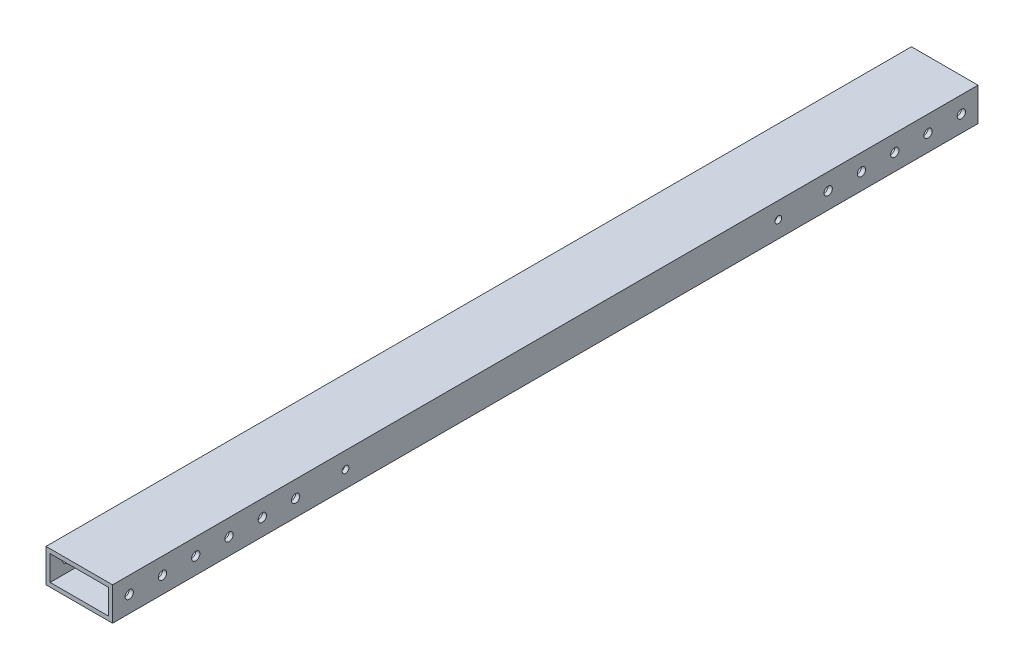
from build123d import *

# Parameters (mm, degrees)
BOSS_EXTRUDE1_DEPTH              = 330.2
BOSS_EXTRUDE1_DEPTH_BACK         = 330.2
SKETCH3_W                        = 50.8
SKETCH3_H                        = 25.4
SKETCH3_W_2                      = 44.45
SKETCH3_H_2                      = 19.05
F_1_4_0_25_DIAMETER_HOLE3_D      = 6.35
F_1_4_0_25_DIAMETER_HOLE4_D      = 6.35
F_1_4_0_25_DIAMETER_HOLE5_D      = 6.35
F_1_4_0_25_DIAMETER_HOLE6_D      = 6.35
F_1_4_0_25_DIAMETER_HOLE7_D      = 6.35
F_1_4_0_25_DIAMETER_HOLE8_D      = 6.35
F_13_64_0_20313_DIAMETER_HOLE1_D = 5.159502
F_1_2_0_5_DIAMETER_HOLE1_D       = 12.7
F_1_2_0_5_DIAMETER_HOLE1_DEPTH   = 6.35
F_1_2_0_5_DIAMETER_HOLE1_TIP     = 3.815464931


with BuildPart() as part:
    # Sketch3 → Boss-Extrude1 (new, two sides: drawn at the far end of the back side and taken through both)
    with BuildSketch(Plane.XY.offset(-BOSS_EXTRUDE1_DEPTH_BACK)):
        Rectangle(SKETCH3_W, SKETCH3_H)
        Rectangle(SKETCH3_W_2, SKETCH3_H_2, mode=Mode.SUBTRACT)
    extrude(amount=BOSS_EXTRUDE1_DEPTH + BOSS_EXTRUDE1_DEPTH_BACK)

    # 1/4 (0.25) Diameter Hole3 (through all)
    with Locations(Plane.ZY.offset(25.4)):
        with Locations((-317.5, 0)):
            Hole(F_1_4_0_25_DIAMETER_HOLE3_D / 2)

    # 1/4 (0.25) Diameter Hole4 (through all)
    with Locations(Plane.ZY.offset(25.4)):
        with Locations((292.1, 0), (317.5, 0)):
            Hole(F_1_4_0_25_DIAMETER_HOLE4_D / 2)

    # 1/4 (0.25) Diameter Hole5 (through all)
    with Locations(Plane(origin=(25.4, 0, 0), x_dir=(0, 0, -1), z_dir=(1, 0, 0))):
        with Locations((292.1, 0), (266.7, 0)):
            Hole(F_1_4_0_25_DIAMETER_HOLE5_D / 2)

    # 1/4 (0.25) Diameter Hole6 (through all)
    with Locations(Plane(origin=(25.4, 0, 0), x_dir=(0, 0, -1), z_dir=(1, 0, 0))):
        with Locations((215.9, 0), (241.3, 0)):
            Hole(F_1_4_0_25_DIAMETER_HOLE6_D / 2)

    # 1/4 (0.25) Diameter Hole7 (through all)
    with Locations(Plane(origin=(25.4, 0, 0), x_dir=(0, 0, -1), z_dir=(1, 0, 0))):
        with Locations((-190.5, 0), (-215.9, 0)):
            Hole(F_1_4_0_25_DIAMETER_HOLE7_D / 2)

    # 1/4 (0.25) Diameter Hole8 (through all)
    with Locations(Plane(origin=(25.4, 0, 0), x_dir=(0, 0, -1), z_dir=(1, 0, 0))):
        with Locations((-266.7, 0), (-241.3, 0)):
            Hole(F_1_4_0_25_DIAMETER_HOLE8_D / 2)

    # 13/64 (0.20313) Diameter Hole1 (through all)
    with Locations(Plane(origin=(25.4, 0, 0), x_dir=(0, 0, -1), z_dir=(1, 0, 0))):
        with Locations((-152.4, 0), (177.8, 0)):
            Hole(F_13_64_0_20313_DIAMETER_HOLE1_D / 2)

    # 1/2 (0.5) Diameter Hole1
    with Locations(Plane.ZY.offset(25.4)):
        with Locations((-146.050000508, 4.9e-08), (120.65, 1.7e-08), (-127.000002025, -2.69e-07), (-101.600002025, -1.95e-07)):
            Hole(F_1_2_0_5_DIAMETER_HOLE1_D / 2, depth=F_1_2_0_5_DIAMETER_HOLE1_DEPTH)
            with Locations((0, 0, -(F_1_2_0_5_DIAMETER_HOLE1_DEPTH + F_1_2_0_5_DIAMETER_HOLE1_TIP / 2))):  # 118° drill point
                Cone(0, F_1_2_0_5_DIAMETER_HOLE1_D / 2, F_1_2_0_5_DIAMETER_HOLE1_TIP, mode=Mode.SUBTRACT)


solid = part.part
